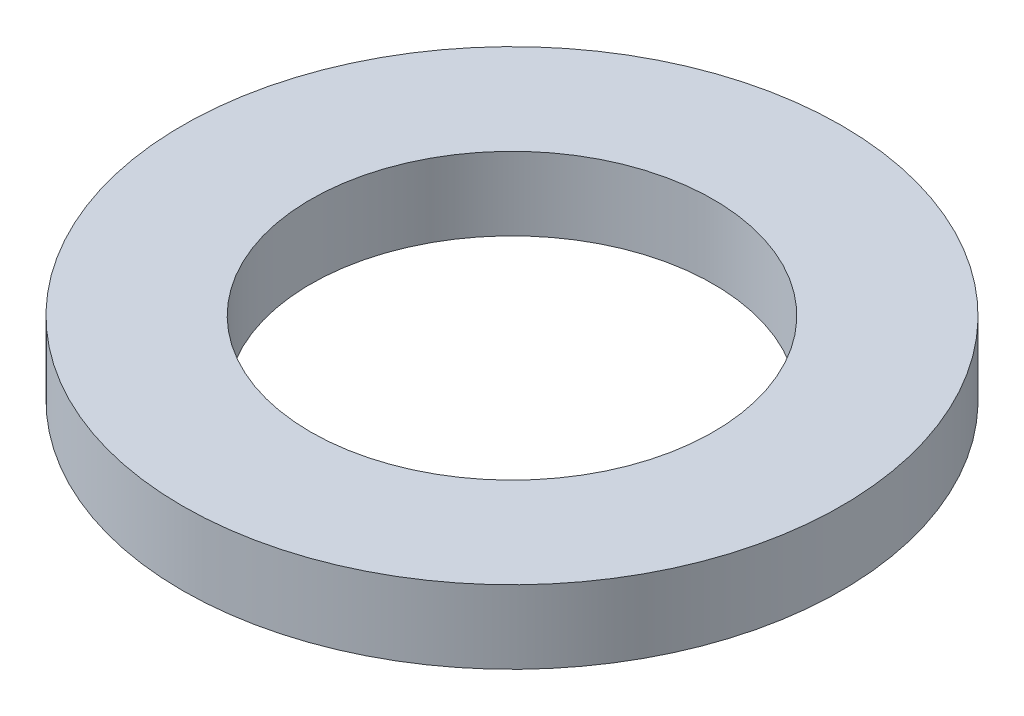
from build123d import *

# Parameters (mm, degrees)
BODYSKE_W = 3.5
BODYSKE_H = 2


with BuildPart() as part:
    # BodySke → BaseBody (revolve)
    with BuildSketch(Plane(origin=(0, 0, 0), x_dir=(1, 0, 0), z_dir=(0, 0, -1)), mode=Mode.PRIVATE) as basebody_sk:
        with Locations((7.25, 1)):
            Rectangle(BODYSKE_W, BODYSKE_H)
    revolve(basebody_sk.sketch.rotate(Axis((0, 0, 0), (0, -1, 0)), 90), axis=Axis((0, 0, 0), (0, -1, 0)))


solid = part.part
